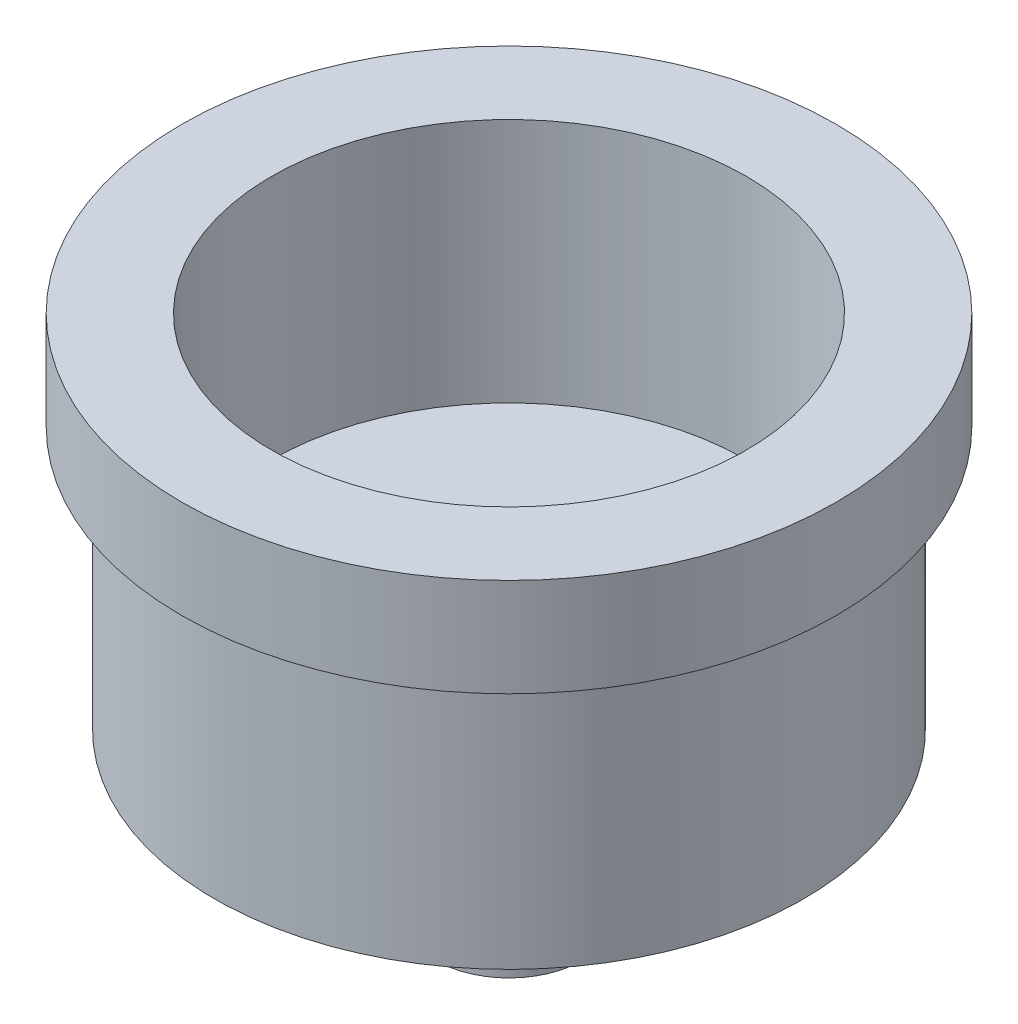
from build123d import *


with BuildPart() as part:
    # 草图1 → 旋转1 (revolve)
    with BuildSketch(Plane.XY, mode=Mode.PRIVATE) as revolve_1_sk:
        Polygon((-20, 32), (-20, 26), (-18, 26), (-18, 10), (-6.5, 10), (-6.5, 9), (-4.5, 9), (-4.5, 0), (-2.5, 0), (-2.5, 13), (-4.75, 13), (-4.75, 17), (-14.5, 17), (-14.5, 32), align=None)
    revolve(revolve_1_sk.sketch.rotate(Axis((0, 0, 0), (0, 1, 0)), 270), axis=Axis((0, 0, 0), (0, 1, 0)))


solid = part.part
